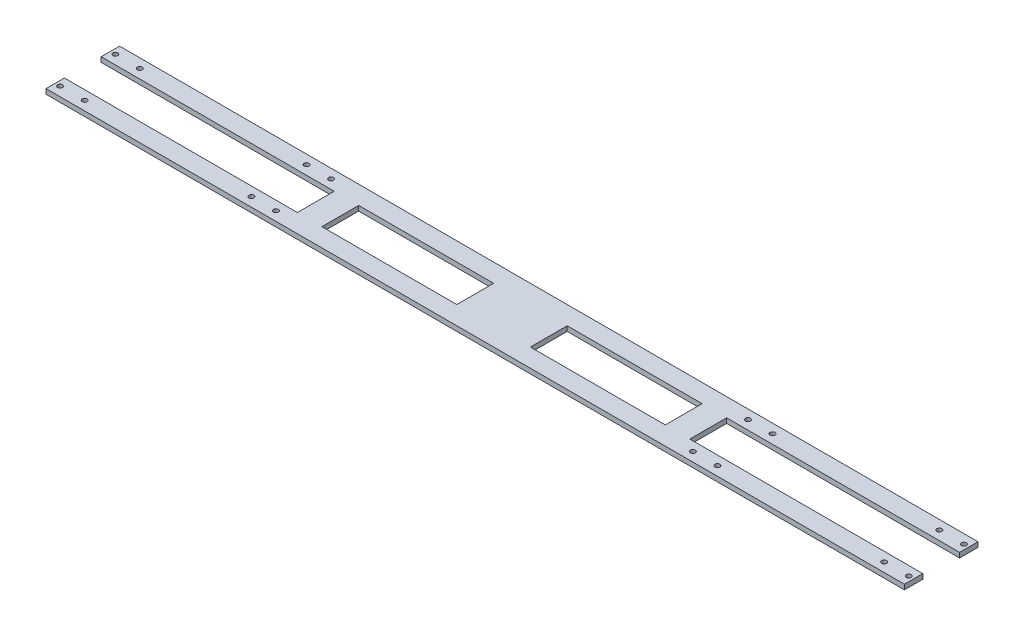
from build123d import *

# Parameters (mm, degrees)
SKETCH_1_W                                 = 700
SKETCH_1_H                                 = 60
SKETCH_1_W_2                               = 280
SKETCH_1_H_2                               = 30
EXTRUDE_1_DEPTH                            = 4
SKETCH_2_W                                 = 190
SKETCH_2_H                                 = 30
CUT_EXTRUDE_1_DEPTH                        = 4
SKETCH_3_R                                 = 2
CUT_EXTRUDE_2_DEPTH                        = 4
MIRROR_2_AT_THE_SECOND_PLANE_COPY_1_SKET_R = 2
MIRROR_2_AT_THE_SECOND_PLANE_COPY_1_DEPTH  = 4
SKETCH_4_W                                 = 60
SKETCH_4_H                                 = 30
EXTRUDE_2_DEPTH                            = 4


with BuildPart() as part:
    # 草图1 → 凸台-拉伸1 (new body)
    with BuildSketch(Plane(origin=(0, 0, 0), x_dir=(1, 0, 0), z_dir=(0, 1, 0))):
        Rectangle(SKETCH_1_W, SKETCH_1_H)
        Rectangle(SKETCH_1_W_2, SKETCH_1_H_2, mode=Mode.SUBTRACT)
    extrude(amount=EXTRUDE_1_DEPTH)

    # 草图2 → 切除-拉伸1 (cut)
    with BuildSketch(Plane(origin=(0, 4, 0), x_dir=(1, 0, 0), z_dir=(0, 1, 0))):
        with Locations((-255, 0)):
            Rectangle(SKETCH_2_W, SKETCH_2_H)
    cut_extrude_1 = extrude(amount=-CUT_EXTRUDE_1_DEPTH, mode=Mode.SUBTRACT)

    # 镜向1: 切除-拉伸1 across plane
    add(cut_extrude_1.mirror(Plane(origin=(0, 0, 0), x_dir=(0, 0, 1), z_dir=(1, 0, 0))), mode=Mode.SUBTRACT)

    # 草图3 → 切除-拉伸2 (cut)
    with BuildSketch(Plane(origin=(0, 4, 0), x_dir=(1, 0, 0), z_dir=(0, 1, 0))):
        with Locations(Location((-190, 22.5, 0), (0, 0, 270))):
            Circle(SKETCH_3_R)
        with Locations(Location((-170, 22.5, 0), (0, 0, 270))):
            Circle(SKETCH_3_R)
        with Locations(Location((-346, 22.5, 0), (0, 0, 270))):
            Circle(SKETCH_3_R)
        with Locations(Location((-326, 22.5, 0), (0, 0, 270))):
            Circle(SKETCH_3_R)
    cut_extrude_2 = extrude(amount=-CUT_EXTRUDE_2_DEPTH, mode=Mode.SUBTRACT)

    # 镜向2: 切除-拉伸2 across plane
    add(cut_extrude_2.mirror(Plane(origin=(0, 0, 0), x_dir=(0, 0, 1), z_dir=(1, 0, 0))), mode=Mode.SUBTRACT)

    # 镜向2 at the second plane: 切除-拉伸2 across plane
    add(cut_extrude_2.mirror(Plane.XY), mode=Mode.SUBTRACT)

    # 镜向2 at the second plane copy 1 sket → 镜向2 at the second plane copy 1 (cut)
    with BuildSketch(Plane(origin=(0, 4, 0), x_dir=(-1, 0, 0), z_dir=(0, 1, 0))):
        with Locations(Location((-190, 22.5, 0), (0, 0, 270))):
            Circle(MIRROR_2_AT_THE_SECOND_PLANE_COPY_1_SKET_R)
        with Locations(Location((-170, 22.5, 0), (0, 0, 270))):
            Circle(MIRROR_2_AT_THE_SECOND_PLANE_COPY_1_SKET_R)
        with Locations(Location((-346, 22.5, 0), (0, 0, 270))):
            Circle(MIRROR_2_AT_THE_SECOND_PLANE_COPY_1_SKET_R)
        with Locations(Location((-326, 22.5, 0), (0, 0, 270))):
            Circle(MIRROR_2_AT_THE_SECOND_PLANE_COPY_1_SKET_R)
    extrude(amount=-MIRROR_2_AT_THE_SECOND_PLANE_COPY_1_DEPTH, mode=Mode.SUBTRACT)

    # 草图4 → 凸台-拉伸2 (add)
    with BuildSketch(Plane(origin=(0, 4, 0), x_dir=(1, 0, 0), z_dir=(0, 1, 0))):
        Rectangle(SKETCH_4_W, SKETCH_4_H)
    extrude(amount=-EXTRUDE_2_DEPTH)


solid = part.part
